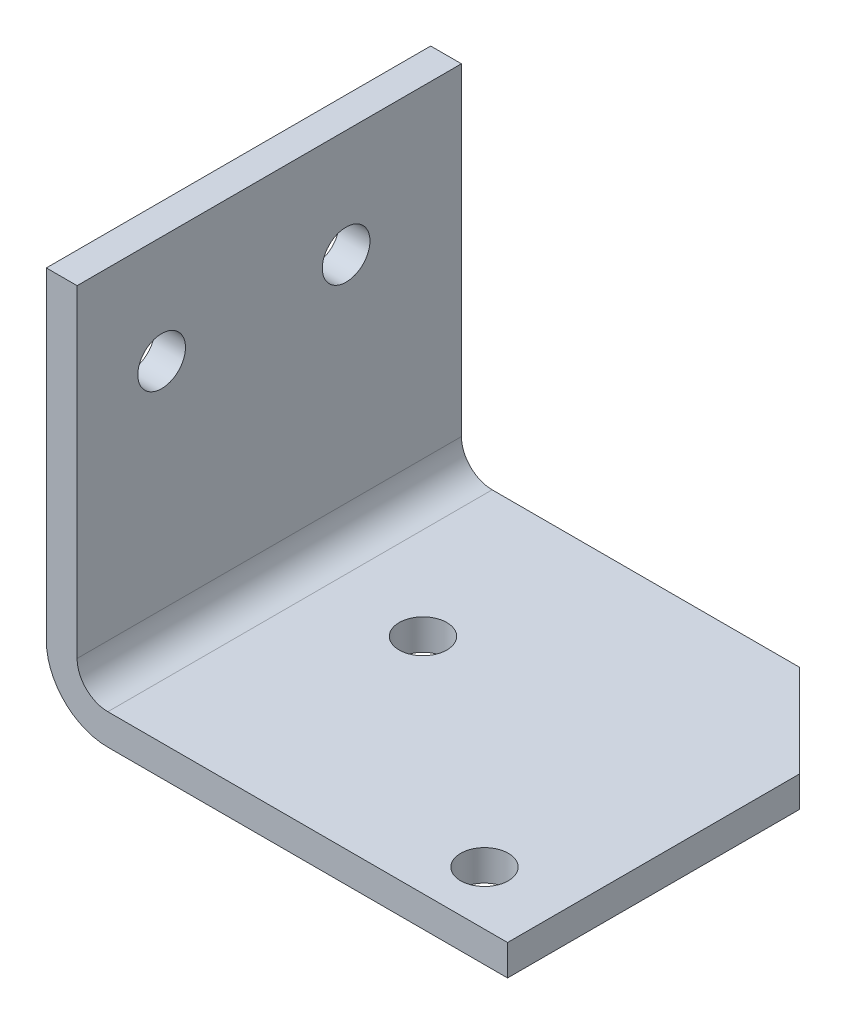
from build123d import *

# Parameters (mm, degrees)
BASE_DEPTH         = 25
SKETCH2_R          = 1.55
CUT_EXTRUDE1_DEPTH = 2
SKETCH4_R          = 1.55
CUT_EXTRUDE3_DEPTH = 47.368092477
CHAMFER2_SIZE      = 6
FILLET1_R          = 2
FILLET2_R          = 4


with BuildPart() as part:
    # Sketch1 → Base (new body)
    with BuildSketch(Plane.XY):
        Polygon((0, 0), (30, 0), (30, 2), (2, 2), (2, 25), (0, 25), align=None)
    extrude(amount=BASE_DEPTH)

    # Sketch2 → Cut-Extrude1 (cut)
    with BuildSketch(Plane.ZY):
        with Locations(Location((19.5, 18, 0), (0, 0, 270))):
            Circle(SKETCH2_R)
        with Locations(Location((7.5, 18, 0), (0, 0, 270))):
            Circle(SKETCH2_R)
    extrude(amount=-CUT_EXTRUDE1_DEPTH, mode=Mode.SUBTRACT)

    # Sketch4 → Cut-Extrude3 (cut, through all)
    with BuildSketch(Plane.XZ):
        with Locations(Location((10, 10.5, 0), (0, 0, 270))):
            Circle(SKETCH4_R)
        with Locations(Location((25, 21.5, 0), (0, 0, 270))):
            Circle(SKETCH4_R)
    extrude(amount=-CUT_EXTRUDE3_DEPTH, mode=Mode.SUBTRACT)

    # Chamfer2
    chamfer2_edges = [part.edges().sort_by_distance(p)[0] for p in [
        (30, 1, 0),
    ]]
    chamfer(chamfer2_edges, length=CHAMFER2_SIZE)

    # Fillet1
    fillet1_edges = [part.edges().sort_by_distance(p)[0] for p in [
        (2, 2, 12.5),
    ]]
    fillet(fillet1_edges, radius=FILLET1_R)

    # Fillet2
    fillet2_edges = [part.edges().sort_by_distance(p)[0] for p in [
        (0, 0, 12.5),
    ]]
    fillet(fillet2_edges, radius=FILLET2_R)


solid = part.part
